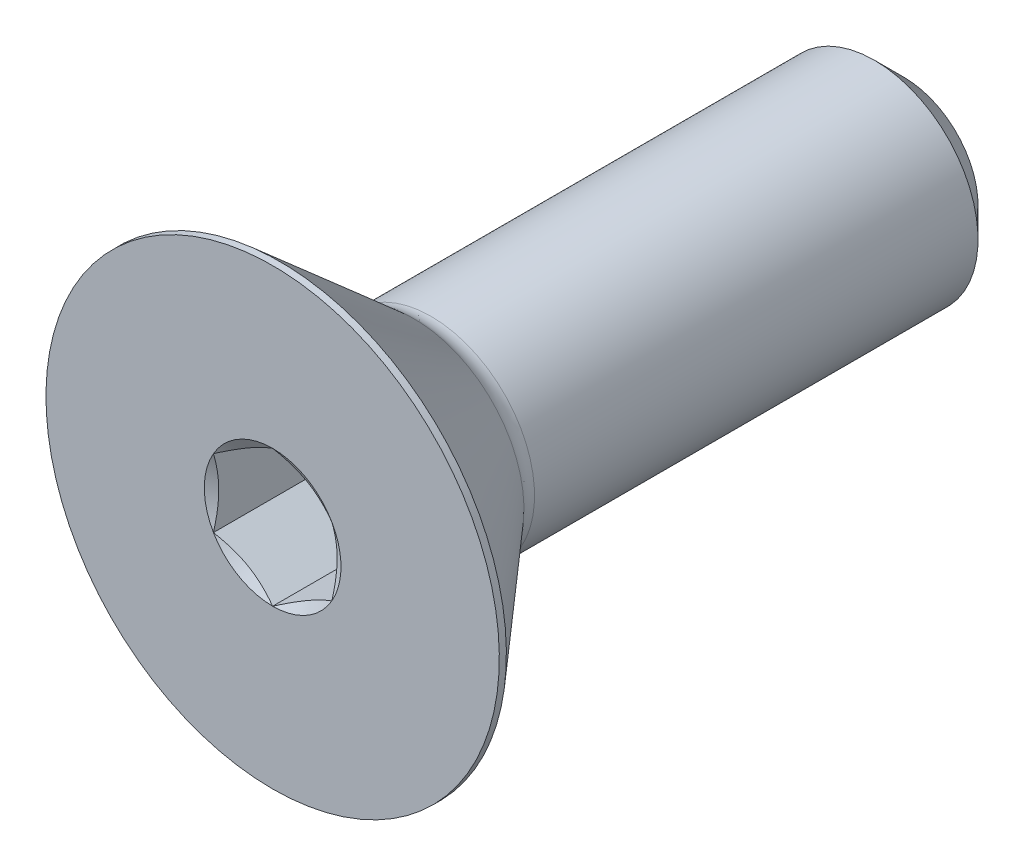
from build123d import *

# Parameters (mm, degrees)
SKETCH1_W          = 12.7
SKETCH1_H          = 2.0828
CHAMFER1_SIZE      = 0.5953125
CUT_EXTRUDE2_DEPTH = 1.99136


with BuildPart() as part:
    # Sketch1 → Revolve1 (revolve)
    with BuildSketch(Plane(origin=(0, 0, 0), x_dir=(0, 0, -1), z_dir=(1, 0, 0))):
        with Locations((6.35, 1.0414)):
            Rectangle(SKETCH1_W, SKETCH1_H)
    revolve(axis=Axis((0, 0, -12.7), (0, 0, 1)))

    # Chamfer1
    chamfer1_edges = [part.edges().sort_by_distance(p)[0] for p in [
        (0, -2.0828, -12.7),
    ]]
    chamfer(chamfer1_edges, length=CHAMFER1_SIZE)

    # Sketch7 → Revolve2 (revolve)
    with BuildSketch(Plane(origin=(0, 0, 0), x_dir=(0, 0, -1), z_dir=(1, 0, 0)), mode=Mode.PRIVATE) as revolve2_sk:
        with BuildLine():
            Line((0, 4.5593), (0.14224, 4.5593))
            Line((0.14224, 4.5593), (2.8448, 2.210000434))
            ThreePointArc((2.8448, 2.210000434), (3.003405714, 2.11563995), (3.185013014, 2.0828))
            Line((3.185013014, 2.0828), (3.185013014, 0))
            Line((3.185013014, 0), (0, 0))
            Line((0, 0), (0, 4.5593))
        make_face()
    revolve(revolve2_sk.sketch.rotate(Axis((0, 0, 0), (0, 0, -1)), 180), axis=Axis((0, 0, 0), (0, 0, -1)))

    # Sketch5 → Cut-Extrude2 (cut)
    with BuildSketch(Plane.XY):
        Polygon((0, 1.374815329), (-1.190625, 0.687407664), (-1.190625, -0.687407664), (0, -1.374815329), (1.190625, -0.687407664), (1.190625, 0.687407664), align=None)
    extrude(amount=-CUT_EXTRUDE2_DEPTH, mode=Mode.SUBTRACT)

    # Cut-Extrude3 cone 1 section (through the dimple's axis) → Cut-Extrude3 (revolve, cut)
    with BuildSketch(Plane(origin=(0, 0, 0), x_dir=(0, -1, 0), z_dir=(1, 0, 0))):
        Polygon((0, 0), (1.374815329, 0), (0, 0.79375), align=None)
    revolve(axis=Axis((0, 0, 0), (0, 0, -1)), mode=Mode.SUBTRACT)


solid = part.part
